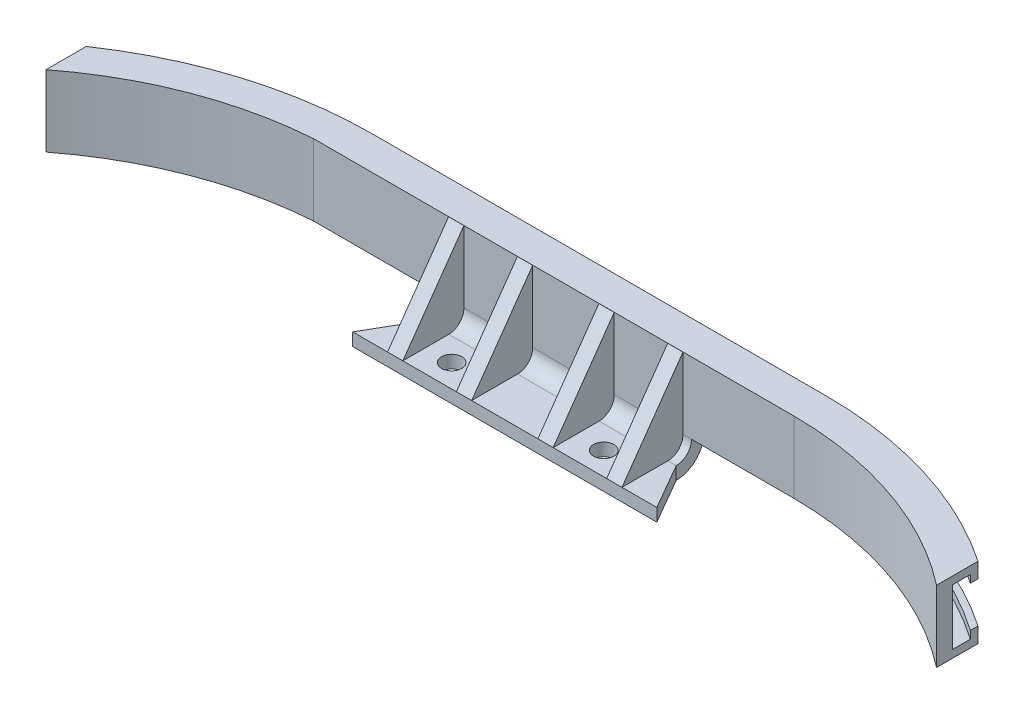
from build123d import *

# Parameters (mm, degrees)
SKETCH1_R                = 2
BOSS_EXTRUDE1_DEPTH      = 2.5
BOSS_EXTRUDE2_DEPTH      = 24.645
BOSS_EXTRUDE2_DEPTH_BACK = 24.645
SKETCH4_W                = 49.29
SKETCH4_H                = 2.5
BOSS_EXTRUDE4_DEPTH      = 14
BOSS_EXTRUDE6_DEPTH      = 1.5
BOSS_EXTRUDE7_START      = 12.5
BOSS_EXTRUDE7_DEPTH      = 1.5
BOSS_EXTRUDE8_START      = 1.5
BOSS_EXTRUDE8_DEPTH      = 1.5
BOSS_EXTRUDE9_START      = 11
BOSS_EXTRUDE9_DEPTH      = 1.5
BOSS_EXTRUDE10_START     = 6.5
BOSS_EXTRUDE10_DEPTH     = 3
BOSS_EXTRUDE11_START     = 20
BOSS_EXTRUDE11_DEPTH     = 3


with BuildPart() as part:
    # Sketch1 → Boss-Extrude1 (new body)
    with BuildSketch(Plane(origin=(0, 0, 0), x_dir=(1, 0, 0), z_dir=(0, 1, 0))):
        Polygon((-29.841152423, 0), (-24.645, 9), (24.645, 9), (29.841152423, 0), align=None)
        with Locations(Location((-14.92, 4.5, 0), (0, 0, 270))):
            Circle(SKETCH1_R, mode=Mode.SUBTRACT)
        with Locations(Location((14.92, 4.5, 0), (0, 0, 270))):
            Circle(SKETCH1_R, mode=Mode.SUBTRACT)
    extrude(amount=BOSS_EXTRUDE1_DEPTH)

    # Sketch3 → Boss-Extrude2 (add, two sides: drawn at the far end of the back side and taken through both)
    with BuildSketch(Plane(origin=(0, 0, 0), x_dir=(0, 0, -1), z_dir=(1, 0, 0)).offset(-BOSS_EXTRUDE2_DEPTH_BACK)):
        with BuildLine():
            Line((9, 0), (9, 2.5))
            ThreePointArc((9, 2.5), (11.121320344, 3.378679656), (12, 5.5))
            Line((12, 5.5), (14.5, 5.5))
            ThreePointArc((14.5, 5.5), (12.889087297, 1.610912703), (9, 0))
        make_face()
    extrude(amount=BOSS_EXTRUDE2_DEPTH + BOSS_EXTRUDE2_DEPTH_BACK)

    # Sketch4 → Boss-Extrude4 (add)
    with BuildSketch(Plane(origin=(0, 5.5, 0), x_dir=(1, 0, 0), z_dir=(0, 1, 0))):
        with BuildLine():
            Line((-49.558586772, 12), (-24.645, 12))
            Line((-24.645, 12), (-24.645, 14.5))
            Line((-24.645, 14.5), (-44.793833293, 14.5))
            ThreePointArc((-44.793833293, 14.5), (-67.270294591, 10.832042119), (-87.5, 0.372393629))
            Line((-87.5, 0.372393629), (-87.5, -2.532989082))
            ThreePointArc((-87.5, -2.532989082), (-69.603961511, 7.539151784), (-49.558586772, 12))
        make_face()
        with Locations((0, 13.25)):
            Rectangle(SKETCH4_W, SKETCH4_H)
        with BuildLine():
            Line((24.645, 12), (44.795929756, 12))
            ThreePointArc((44.795929756, 12), (67.371893328, 8.158628084), (87.5, -2.763349356))
            Line((87.5, -2.763349356), (87.5, 0.372340835))
            ThreePointArc((87.5, 0.372340835), (67.265225258, 10.833674125), (44.783151118, 14.5))
            Line((44.783151118, 14.5), (24.645, 14.5))
            Line((24.645, 14.5), (24.645, 12))
        make_face()
    extrude(amount=BOSS_EXTRUDE4_DEPTH)

    # Sketch4<4> → Boss-Extrude6 (add)
    with BuildSketch(Plane(origin=(0, 5.5, 0), x_dir=(1, 0, 0), z_dir=(0, 1, 0))):
        with BuildLine():
            ThreePointArc((44.783151118, 14.5), (67.265225258, 10.833674125), (87.5, 0.372340835))
            Line((87.5, 0.372340835), (87.5, 3.872340835))
            ThreePointArc((87.5, 3.872340835), (67.030937137, 13.899537079), (44.500036985, 17.347106846))
            Line((44.500036985, 17.347106846), (-44.499963015, 17.347150533))
            ThreePointArc((-44.499963015, 17.347150533), (-67.030900409, 13.89959402), (-87.5, 3.872393629))
            Line((-87.5, 3.872393629), (-87.5, 0.372393629))
            ThreePointArc((-87.5, 0.372393629), (-67.270294591, 10.832042119), (-44.793833293, 14.5))
            Line((-44.793833293, 14.5), (-24.645, 14.5))
            Line((-24.645, 14.5), (24.645, 14.5))
            Line((24.645, 14.5), (44.783151118, 14.5))
        make_face()
        with BuildLine():
            ThreePointArc((87.5, 3.872340835), (67.030937113, 13.899537086), (44.500036985, 17.347106846))
            Line((44.500036985, 17.347106846), (-44.499963015, 17.347150533))
            ThreePointArc((-44.499963015, 17.347150533), (-67.030900409, 13.89959402), (-87.5, 3.872393629))
            Line((-87.5, 3.872393629), (-87.5, 5.372393629))
            ThreePointArc((-87.5, 5.372393629), (-66.991859053, 15.206396924), (-44.499962408, 18.583681514))
            Line((-44.499962408, 18.583681514), (44.500037592, 18.583637828))
            ThreePointArc((44.500037592, 18.583637828), (66.991896325, 15.206339771), (87.5, 5.372340835))
            Line((87.5, 5.372340835), (87.5, 3.872340835))
        make_face()
    extrude(amount=BOSS_EXTRUDE6_DEPTH)

    # Sketch4<5> → Boss-Extrude7 (add)
    with BuildSketch(Plane(origin=(0, 5.5, 0), x_dir=(1, 0, 0), z_dir=(0, 1, 0)).offset(BOSS_EXTRUDE7_START)):
        with BuildLine():
            ThreePointArc((44.783151118, 14.5), (67.265225258, 10.833674125), (87.5, 0.372340835))
            Line((87.5, 0.372340835), (87.5, 3.872340835))
            ThreePointArc((87.5, 3.872340835), (67.030937137, 13.899537079), (44.500036985, 17.347106846))
            Line((44.500036985, 17.347106846), (-44.499963015, 17.347150533))
            ThreePointArc((-44.499963015, 17.347150533), (-67.030900409, 13.89959402), (-87.5, 3.872393629))
            Line((-87.5, 3.872393629), (-87.5, 0.372393629))
            ThreePointArc((-87.5, 0.372393629), (-67.270294591, 10.832042119), (-44.793833293, 14.5))
            Line((-44.793833293, 14.5), (-24.645, 14.5))
            Line((-24.645, 14.5), (24.645, 14.5))
            Line((24.645, 14.5), (44.783151118, 14.5))
        make_face()
        with BuildLine():
            ThreePointArc((87.5, 3.872340835), (67.030937113, 13.899537086), (44.500036985, 17.347106846))
            Line((44.500036985, 17.347106846), (-44.499963015, 17.347150533))
            ThreePointArc((-44.499963015, 17.347150533), (-67.030900409, 13.89959402), (-87.5, 3.872393629))
            Line((-87.5, 3.872393629), (-87.5, 5.372393629))
            ThreePointArc((-87.5, 5.372393629), (-66.991859053, 15.206396924), (-44.499962408, 18.583681514))
            Line((-44.499962408, 18.583681514), (44.500037592, 18.583637828))
            ThreePointArc((44.500037592, 18.583637828), (66.991896325, 15.206339771), (87.5, 5.372340835))
            Line((87.5, 5.372340835), (87.5, 3.872340835))
        make_face()
    extrude(amount=BOSS_EXTRUDE7_DEPTH)

    # Sketch4<6> → Boss-Extrude8 (add)
    with BuildSketch(Plane(origin=(0, 5.5, 0), x_dir=(1, 0, 0), z_dir=(0, 1, 0)).offset(BOSS_EXTRUDE8_START)):
        with BuildLine():
            ThreePointArc((87.5, 3.872340835), (67.030937113, 13.899537086), (44.500036985, 17.347106846))
            Line((44.500036985, 17.347106846), (-44.499963015, 17.347150533))
            ThreePointArc((-44.499963015, 17.347150533), (-67.030900409, 13.89959402), (-87.5, 3.872393629))
            Line((-87.5, 3.872393629), (-87.5, 5.372393629))
            ThreePointArc((-87.5, 5.372393629), (-66.991859053, 15.206396924), (-44.499962408, 18.583681514))
            Line((-44.499962408, 18.583681514), (44.500037592, 18.583637828))
            ThreePointArc((44.500037592, 18.583637828), (66.991896325, 15.206339771), (87.5, 5.372340835))
            Line((87.5, 5.372340835), (87.5, 3.872340835))
        make_face()
    extrude(amount=BOSS_EXTRUDE8_DEPTH)

    # Sketch4<8> → Boss-Extrude9 (add)
    with BuildSketch(Plane(origin=(0, 5.5, 0), x_dir=(1, 0, 0), z_dir=(0, 1, 0)).offset(BOSS_EXTRUDE9_START)):
        with BuildLine():
            ThreePointArc((87.5, 3.872340835), (67.030937113, 13.899537086), (44.500036985, 17.347106846))
            Line((44.500036985, 17.347106846), (-44.499963015, 17.347150533))
            ThreePointArc((-44.499963015, 17.347150533), (-67.030900409, 13.89959402), (-87.5, 3.872393629))
            Line((-87.5, 3.872393629), (-87.5, 5.372393629))
            ThreePointArc((-87.5, 5.372393629), (-66.991859053, 15.206396924), (-44.499962408, 18.583681514))
            Line((-44.499962408, 18.583681514), (44.500037592, 18.583637828))
            ThreePointArc((44.500037592, 18.583637828), (66.991896325, 15.206339771), (87.5, 5.372340835))
            Line((87.5, 5.372340835), (87.5, 3.872340835))
        make_face()
    extrude(amount=BOSS_EXTRUDE9_DEPTH)

    # Sketch5 → Boss-Extrude10 (add)
    with BuildSketch(Plane(origin=(0, 0, 0), x_dir=(0, 0, -1), z_dir=(1, 0, 0)).offset(BOSS_EXTRUDE10_START)):
        with BuildLine():
            Line((11.977989331, 19.5), (0, 2.5))
            Line((0, 2.5), (9, 2.5))
            ThreePointArc((9, 2.5), (11.113552723, 3.380024256), (11.977989331, 5.5))
            Line((11.977989331, 5.5), (11.977989331, 19.5))
        make_face()
    boss_extrude10 = extrude(amount=BOSS_EXTRUDE10_DEPTH)

    # Sketch5<3> → Boss-Extrude11 (add)
    with BuildSketch(Plane(origin=(0, 0, 0), x_dir=(0, 0, -1), z_dir=(1, 0, 0)).offset(BOSS_EXTRUDE11_START)):
        with BuildLine():
            Line((11.977989331, 19.5), (0, 2.5))
            Line((0, 2.5), (9, 2.5))
            ThreePointArc((9, 2.5), (11.113552723, 3.380024256), (11.977989331, 5.5))
            Line((11.977989331, 5.5), (11.977989331, 19.5))
        make_face()
    boss_extrude11 = extrude(amount=BOSS_EXTRUDE11_DEPTH)

    # Mirror1: Boss-Extrude10, Boss-Extrude11 across plane
    add(boss_extrude10.mirror(Plane(origin=(0, 0, 0), x_dir=(0, 0, 1), z_dir=(1, 0, 0))))
    add(boss_extrude11.mirror(Plane(origin=(0, 0, 0), x_dir=(0, 0, 1), z_dir=(1, 0, 0))))


solid = part.part
